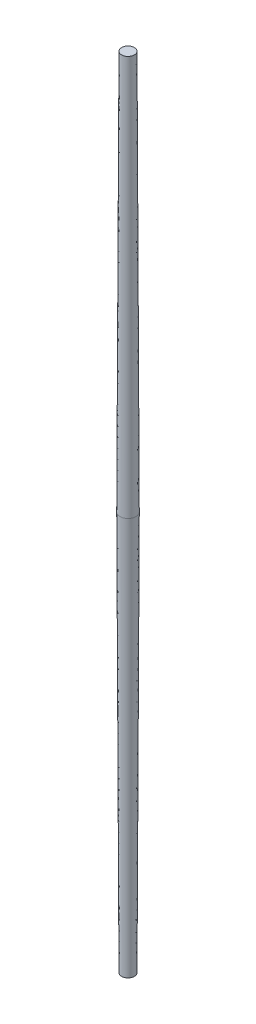
from build123d import *


with BuildPart() as part:
    # Esquisse1 → Révolution1 (revolve)
    with BuildSketch(Plane.XY, mode=Mode.PRIVATE) as r_volution1_sk:
        Polygon((0, 0), (5, 0), (4, 250), (0, 250), align=None)
    r_volution1 = revolve(r_volution1_sk.sketch.rotate(Axis((0, 250, 0), (0, -1, 0)), 180), axis=Axis((0, 250, 0), (0, -1, 0)))

    # Symétrie1: Révolution1 across plane
    add(r_volution1.mirror(Plane.ZX))


solid = part.part
